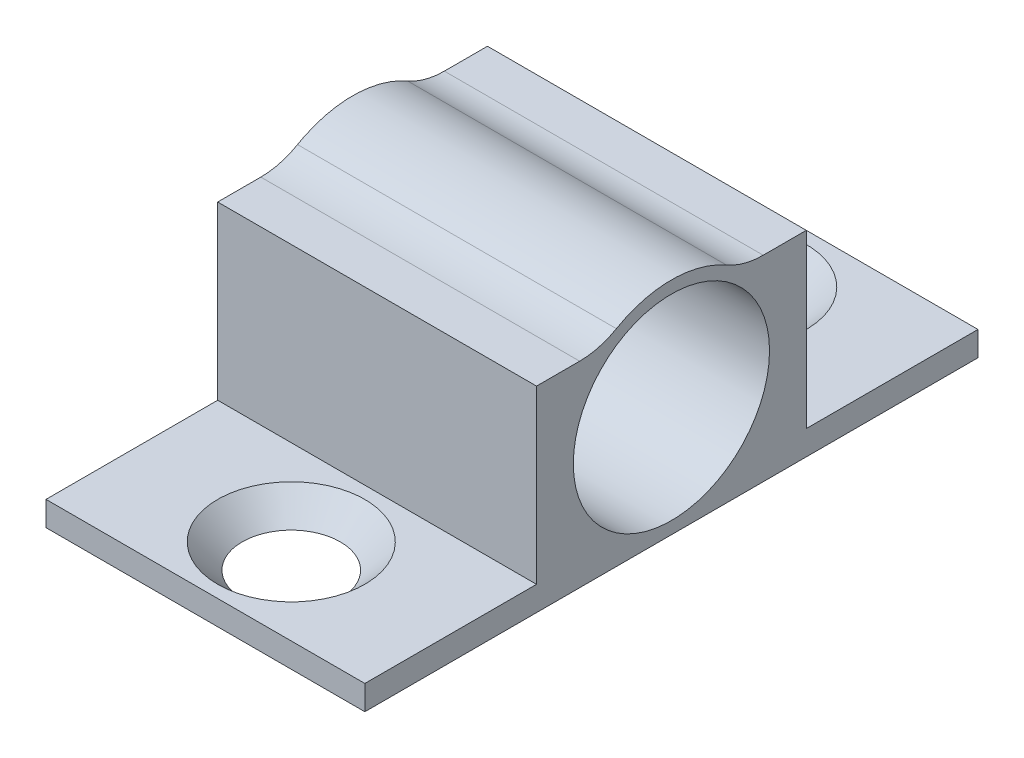
from build123d import *

# Parameters (mm, degrees)
SKETCH1_W                                      = 13
SKETCH1_H                                      = 25
BOSS_EXTRUDE1_DEPTH                            = 1
SKETCH3_W                                      = 13
SKETCH3_H                                      = 11
BOSS_EXTRUDE2_DEPTH                            = 7
SKETCH4_R                                      = 4.5
BOSS_EXTRUDE3_DEPTH                            = 13
SKETCH6_R                                      = 4
CUT_EXTRUDE1_DEPTH                             = 30.58042089
FILLET1_R                                      = 3
CSK_FOR_M3_OVAL_HEAD_MACHINE_SCREW2_AT_2_COUNT = 2
CSK_FOR_M3_OVAL_HEAD_MACHINE_SCREW2_AT_2_PITCH = 18


with BuildPart() as part:
    # Sketch1 → Boss-Extrude1 (new body)
    with BuildSketch(Plane(origin=(0, 0, 0), x_dir=(1, 0, 0), z_dir=(0, 1, 0))):
        with Locations((6.5, 12.5)):
            Rectangle(SKETCH1_W, SKETCH1_H)
    extrude(amount=BOSS_EXTRUDE1_DEPTH)

    # Sketch3 → Boss-Extrude2 (add)
    with BuildSketch(Plane(origin=(0, 1, 0), x_dir=(1, 0, 0), z_dir=(0, 1, 0))):
        with Locations((6.5, 12.5)):
            Rectangle(SKETCH3_W, SKETCH3_H)
    extrude(amount=BOSS_EXTRUDE2_DEPTH)

    # Sketch4 → Boss-Extrude3 (add, through all)
    with BuildSketch(Plane(origin=(13, 0, 0), x_dir=(0, 0, -1), z_dir=(1, 0, 0))):
        with Locations((12.5, 4.5)):
            Circle(SKETCH4_R)
    extrude(amount=-BOSS_EXTRUDE3_DEPTH)

    # Sketch6 → Cut-Extrude1 (cut, through all)
    with BuildSketch(Plane.ZY.offset(5e-05)):
        with Locations((-12.5, 4.5)):
            Circle(SKETCH6_R)
    extrude(amount=-CUT_EXTRUDE1_DEPTH, mode=Mode.SUBTRACT)

    # Fillet1
    fillet1_edges = [part.edges().sort_by_distance(p)[0] for p in [
        (6.5, 8, -15.328427125),
        (6.5, 8, -9.671572875),
    ]]
    fillet(fillet1_edges, radius=FILLET1_R)

    # Sketch15 → CSK for M3 Oval Head Machine Screw2 (revolve, cut)
    with BuildSketch(Plane(origin=(6.5, 1, -3.5), x_dir=(0, 0, 1), z_dir=(1, 0, 0))):
        Polygon((0, 0), (0, 1), (1.75, 1), (1.75, 1.25), (3, 0), align=None)
    csk_for_m3_oval_head_machine_screw2 = revolve(axis=Axis((6.5, 7.35, -3.5), (0, -1, 0)), mode=Mode.SUBTRACT)

    # CSK for M3 Oval Head Machine Screw2 at 2: CSK for M3 Oval Head Machine Screw2 ×2
    with Locations(*[(0, 0, -i * CSK_FOR_M3_OVAL_HEAD_MACHINE_SCREW2_AT_2_PITCH) for i in range(1, CSK_FOR_M3_OVAL_HEAD_MACHINE_SCREW2_AT_2_COUNT)]):
        add(csk_for_m3_oval_head_machine_screw2, mode=Mode.SUBTRACT)


solid = part.part
